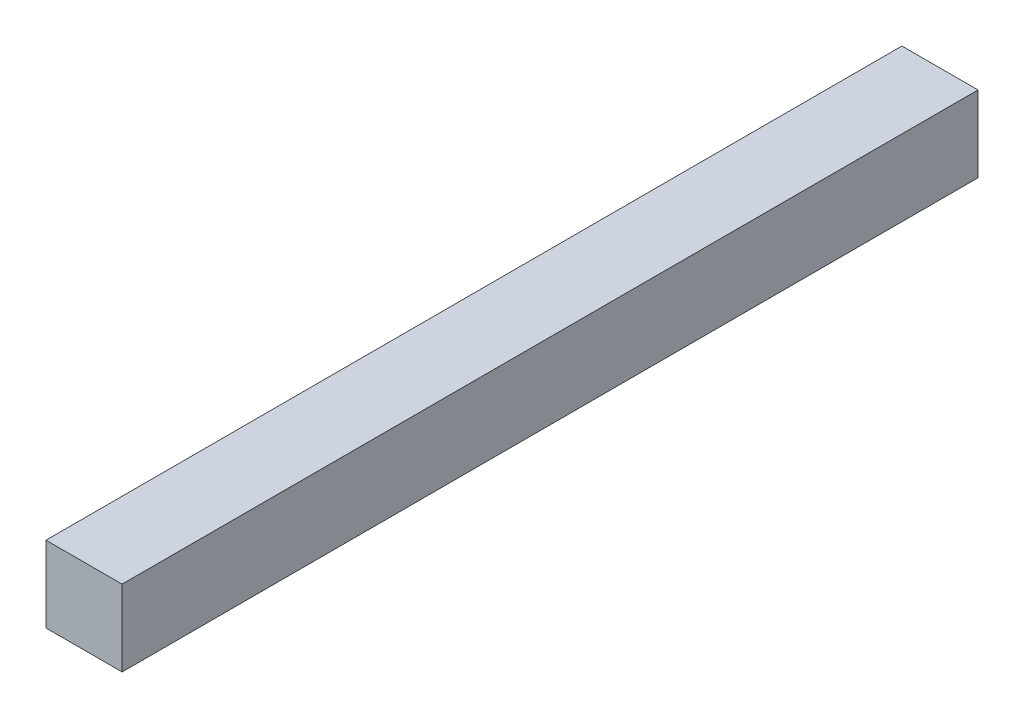
from build123d import *

# Parameters (mm, degrees)
CROQUIS1_W              = 88.9
CROQUIS1_H              = 88.9
SALIENTE_EXTRUIR1_DEPTH = 1000


with BuildPart() as part:
    # Croquis1 → Saliente-Extruir1 (new body)
    with BuildSketch(Plane.XY):
        with Locations((44.45, -44.45)):
            Rectangle(CROQUIS1_W, CROQUIS1_H)
    extrude(amount=SALIENTE_EXTRUIR1_DEPTH)


solid = part.part
